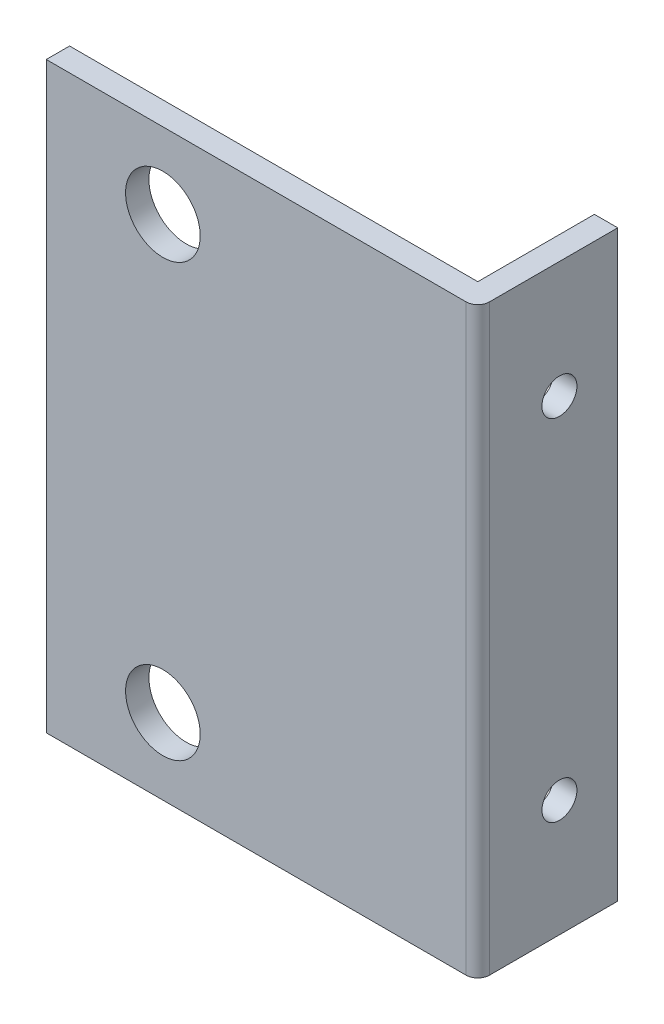
from build123d import *

# Parameters (mm, degrees)
BOSS_EXTRUDE1_DEPTH = 50
FILLET2_R           = 1
SKETCH4_R           = 1.5
CUT_EXTRUDE1_DEPTH  = 64.348243859
SKETCH5_R           = 3.2
CUT_EXTRUDE2_DEPTH  = 64.348243859


with BuildPart() as part:
    # Sketch3 → Boss-Extrude1 (new body)
    with BuildSketch(Plane(origin=(0, 0, 0), x_dir=(1, 0, 0), z_dir=(0, 1, 0))):
        Polygon((0, 0), (37, 0), (37, 12), (35, 12), (35, 2), (0, 2), align=None)
    extrude(amount=BOSS_EXTRUDE1_DEPTH)

    # Fillet2
    fillet2_edges = [part.edges().sort_by_distance(p)[0] for p in [
        (37, 25, 0),
    ]]
    fillet(fillet2_edges, radius=FILLET2_R)

    # Sketch4 → Cut-Extrude1 (cut, through all)
    with BuildSketch(Plane(origin=(37, 0, 0), x_dir=(0, 0, -1), z_dir=(1, 0, 0))):
        with Locations((7, 40)):
            Circle(SKETCH4_R)
        with Locations((7, 10)):
            Circle(SKETCH4_R)
    extrude(amount=-CUT_EXTRUDE1_DEPTH, mode=Mode.SUBTRACT)

    # Sketch5 → Cut-Extrude2 (cut, through all)
    with BuildSketch(Plane.XY):
        with Locations((10, 43.5)):
            Circle(SKETCH5_R)
        with Locations((10, 6.5)):
            Circle(SKETCH5_R)
    extrude(amount=-CUT_EXTRUDE2_DEPTH, mode=Mode.SUBTRACT)


solid = part.part
